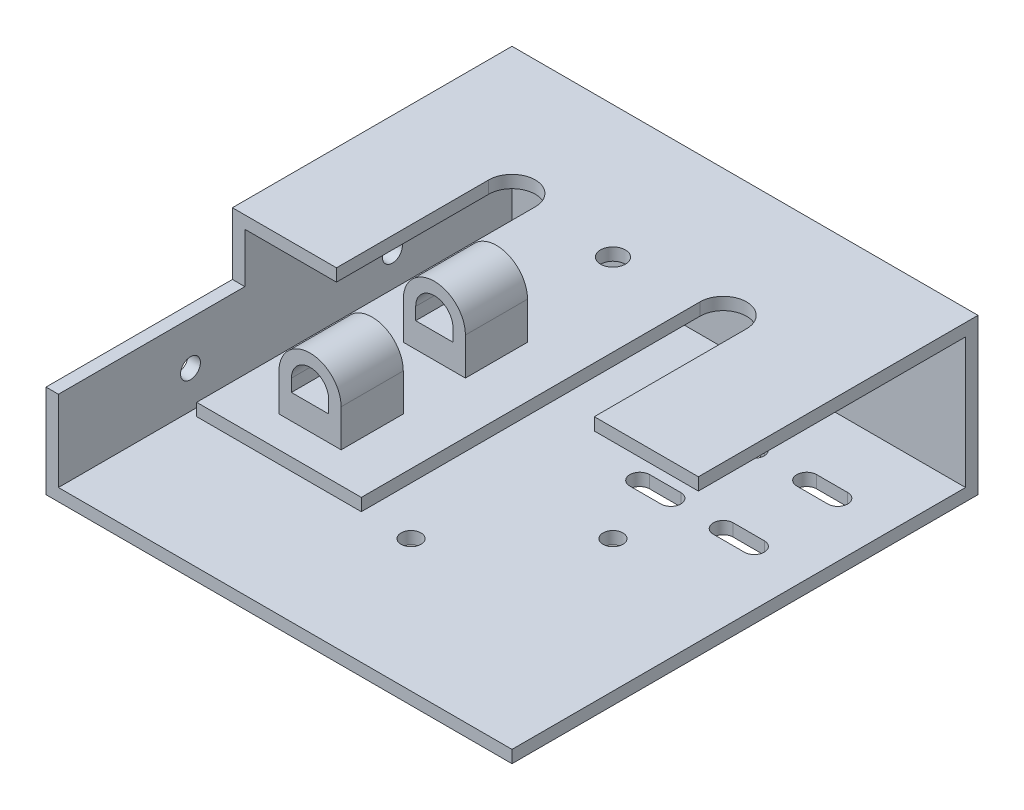
from build123d import *

# Parameters (mm, degrees)
SKETCH2_W           = 75
SKETCH2_H           = 75
BOSS_EXTRUDE1_DEPTH = 25
SHELL1_T            = -2
SKETCH3_R           = 1.6
CUT_EXTRUDE1_DEPTH  = 50
CUT_EXTRUDE2_DEPTH  = 10
BOSS_EXTRUDE2_START = -5
BOSS_EXTRUDE2_DEPTH = 10
LPATTERN1_COUNT     = 2
LPATTERN1_PITCH     = 20
SKETCH7_R           = 1.6
CUT_EXTRUDE4_DEPTH  = 10
SKETCH9_R           = 1.6
CUT_EXTRUDE5_DEPTH  = 10
SKETCH10_R          = 2
CUT_EXTRUDE6_DEPTH  = 10
CUT_EXTRUDE7_START  = -10
CUT_EXTRUDE7_DEPTH  = 10


with BuildPart() as part:
    # Sketch2 → Boss-Extrude1 (new body)
    with BuildSketch(Plane(origin=(0, 0, 0), x_dir=(1, 0, 0), z_dir=(0, 1, 0))):
        Rectangle(SKETCH2_W, SKETCH2_H)
    extrude(amount=BOSS_EXTRUDE1_DEPTH)

    # Shell1
    shell1_openings = [part.faces().sort_by_distance(p)[0] for p in [
        (0, 12.5, 37.5),
        (37.5, 12.5, 0),
    ]]
    offset(amount=SHELL1_T, openings=shell1_openings, kind=Kind.INTERSECTION)

    # Sketch3 → Cut-Extrude1 (cut)
    with BuildSketch(Plane(origin=(0, 2, 0), x_dir=(1, 0, 0), z_dir=(0, 1, 0))):
        with Locations((-23.717514421, 23.717514421)):
            Circle(SKETCH3_R)
        with Locations((-10.282485579, 23.717514421)):
            Circle(SKETCH3_R)
        with Locations((-10.282485579, 10.282485579)):
            Circle(SKETCH3_R)
        with Locations((-23.717514421, 10.282485579)):
            Circle(SKETCH3_R)
        with Locations((10.282485579, 23.717514421)):
            Circle(SKETCH3_R)
        with Locations((23.717514421, 23.717514421)):
            Circle(SKETCH3_R)
        with Locations((10.282485579, 10.282485579)):
            Circle(SKETCH3_R)
        with Locations((23.717514421, 10.282485579)):
            Circle(SKETCH3_R)
    extrude(amount=-CUT_EXTRUDE1_DEPTH, mode=Mode.SUBTRACT)

    # Sketch4 → Cut-Extrude2 (cut)
    with BuildSketch(Plane(origin=(0, 25, 0), x_dir=(1, 0, 0), z_dir=(0, 1, 0))):
        with BuildLine():
            Line((-37.5, -37.5), (-13.25, -37.5))
            Line((-13.25, -37.5), (-13.25, -7.5))
            Line((-13.25, -7.5), (-13.25, 17))
            ThreePointArc((-13.25, 17), (-17, 20.75), (-20.75, 17))
            Line((-20.75, 17), (-20.75, -7.5))
            Line((-20.75, -7.5), (-37.5, -7.5))
            Line((-37.5, -7.5), (-37.5, -37.5))
        make_face()
        with BuildLine():
            Line((37.5, -37.5), (37.5, -7.5))
            Line((37.5, -7.5), (20.75, -7.5))
            Line((20.75, -7.5), (20.75, 17))
            ThreePointArc((20.75, 17), (17, 20.75), (13.25, 17))
            Line((13.25, 17), (13.25, -7.5))
            Line((13.25, -7.5), (13.25, -37.5))
            Line((13.25, -37.5), (37.5, -37.5))
        make_face()
    extrude(amount=-CUT_EXTRUDE2_DEPTH, mode=Mode.SUBTRACT)

    # Sketch5 → Boss-Extrude2 (add)
    with BuildSketch(Plane.XY.offset(37.5).offset(BOSS_EXTRUDE2_START)):
        with BuildLine():
            Line((-5, 25), (-5, 31))
            ThreePointArc((-5, 31), (0, 36), (5, 31))
            Line((5, 31), (5, 25))
            Line((5, 25), (-5, 25))
        make_face()
        with BuildLine():
            Line((-3, 31), (-3, 29))
            Line((-3, 29), (3, 29))
            Line((3, 29), (3, 31))
            ThreePointArc((3, 31), (0, 34), (-3, 31))
        make_face(mode=Mode.SUBTRACT)
    boss_extrude2 = extrude(amount=-BOSS_EXTRUDE2_DEPTH)

    # LPattern1: Boss-Extrude2 ×2
    with Locations(*[(0, 0, -i * LPATTERN1_PITCH) for i in range(1, LPATTERN1_COUNT)]):
        add(boss_extrude2)

    # Sketch7 → Cut-Extrude4 (cut)
    with BuildSketch(Plane.XZ):
        with Locations((0, 16.25)):
            Circle(SKETCH7_R)
        with Locations((16.25, 0)):
            Circle(SKETCH7_R)
        with Locations((0, -16.25)):
            Circle(SKETCH7_R)
        with Locations((-16.25, 0)):
            Circle(SKETCH7_R)
    extrude(amount=-CUT_EXTRUDE4_DEPTH, mode=Mode.SUBTRACT)

    # Sketch9 → Cut-Extrude5 (cut)
    with BuildSketch(Plane(origin=(-35.5, 0, 0), x_dir=(0, 0, -1), z_dir=(1, 0, 0))):
        with Locations((-16.25, 8)):
            Circle(SKETCH9_R)
        with Locations((16.25, 8)):
            Circle(SKETCH9_R)
    extrude(amount=-CUT_EXTRUDE5_DEPTH, mode=Mode.SUBTRACT)

    # Sketch10 → Cut-Extrude6 (cut)
    with BuildSketch(Plane(origin=(0, 25, 0), x_dir=(1, 0, 0), z_dir=(0, 1, 0))):
        with Locations((0, 16.25)):
            Circle(SKETCH10_R)
    extrude(amount=-CUT_EXTRUDE6_DEPTH, mode=Mode.SUBTRACT)

    # Sketch11 → Cut-Extrude7 (cut)
    with BuildSketch(Plane.XZ.offset(CUT_EXTRUDE7_START)):
        with BuildLine():
            Line((10.282485579, -8.682485579), (15.282485579, -8.682485579))
            ThreePointArc((15.282485579, -8.682485579), (16.882485579, -10.282485579), (15.282485579, -11.882485579))
            Line((15.282485579, -11.882485579), (10.282485579, -11.882485579))
            ThreePointArc((10.282485579, -11.882485579), (8.682485579, -10.282485579), (10.282485579, -8.682485579))
        make_face()
        with BuildLine():
            Line((23.717514421, -8.682485579), (28.717514421, -8.682485579))
            ThreePointArc((28.717514421, -8.682485579), (30.317514421, -10.282485579), (28.717514421, -11.882485579))
            Line((28.717514421, -11.882485579), (23.717514421, -11.882485579))
            ThreePointArc((23.717514421, -11.882485579), (22.117514421, -10.282485579), (23.717514421, -8.682485579))
        make_face()
        with BuildLine():
            Line((23.717514421, -22.117514421), (28.717514421, -22.117514421))
            ThreePointArc((28.717514421, -22.117514421), (30.317514421, -23.717514421), (28.717514421, -25.317514421))
            Line((28.717514421, -25.317514421), (23.717514421, -25.317514421))
            ThreePointArc((23.717514421, -25.317514421), (22.117514421, -23.717514421), (23.717514421, -22.117514421))
        make_face()
        with BuildLine():
            Line((10.282485579, -22.117514421), (15.282485579, -22.117514421))
            ThreePointArc((15.282485579, -22.117514421), (16.882485579, -23.717514421), (15.282485579, -25.317514421))
            Line((15.282485579, -25.317514421), (10.282485579, -25.317514421))
            ThreePointArc((10.282485579, -25.317514421), (8.682485579, -23.717514421), (10.282485579, -22.117514421))
        make_face()
    extrude(amount=CUT_EXTRUDE7_DEPTH, mode=Mode.SUBTRACT)


solid = part.part
